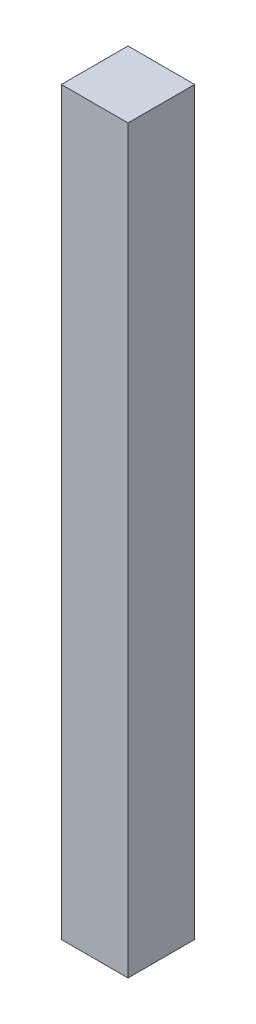
from build123d import *

# Parameters (mm, degrees)
TOPPING_KLAPE_KAT2_GAZLI_AMORTISOR_1_1_START = 8
SKETCH1_W                                    = 18
SKETCH1_H                                    = 200
TOPPING_KLAPE_KAT2_GAZLI_AMORTISOR_1_1_DEPTH = 18


with BuildPart() as part:
    # Sketch1 → TOPPING_klape_kat2_gazli_amortisor_1_1 (new body)
    with BuildSketch(Plane.XY.offset(TOPPING_KLAPE_KAT2_GAZLI_AMORTISOR_1_1_START)):
        with Locations((54, 1280)):
            Rectangle(SKETCH1_W, SKETCH1_H)
    extrude(amount=TOPPING_KLAPE_KAT2_GAZLI_AMORTISOR_1_1_DEPTH)


solid = part.part
